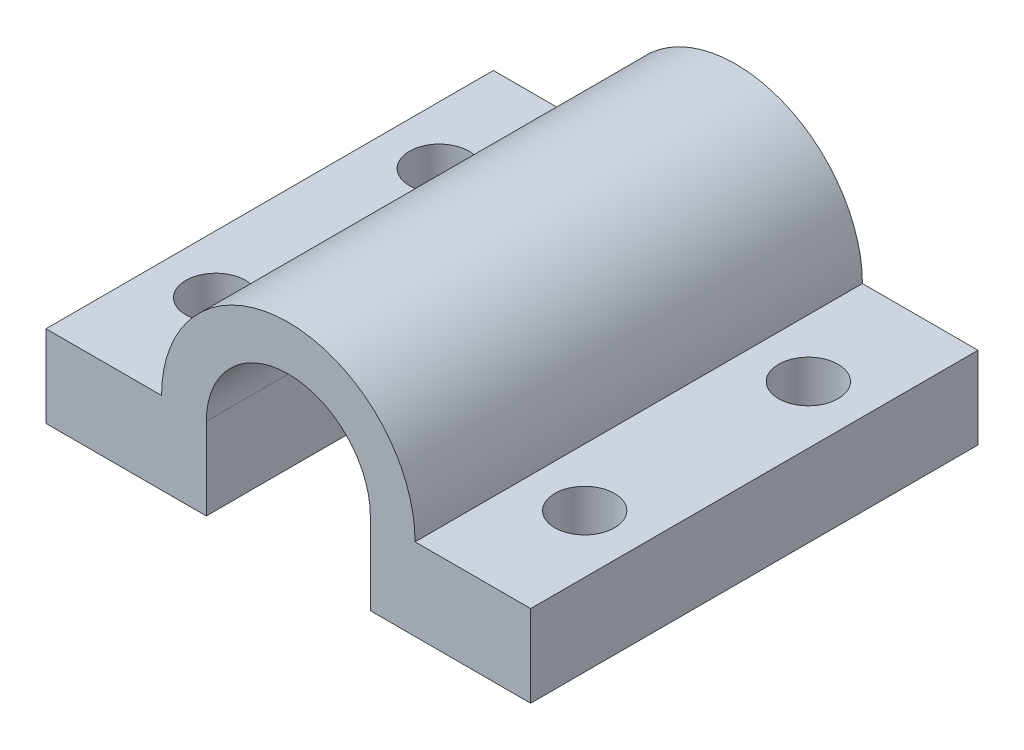
from build123d import *

# Parameters (mm, degrees)
BOSS_EXTRUDE1_DEPTH = 12
SKETCH2_R           = 0.8
CUT_EXTRUDE1_DEPTH  = 20


with BuildPart() as part:
    # Sketch1 → Boss-Extrude1 (new body)
    with BuildSketch(Plane.XY):
        with BuildLine():
            Line((-2.2, 0), (-2.2, -2.2))
            Line((-2.2, -2.2), (-6.5, -2.2))
            Line((-6.5, -2.2), (-6.5, 0))
            Line((-6.5, 0), (-3.4, 0))
            ThreePointArc((-3.4, 0), (0, 3.4), (3.4, 0))
            Line((3.4, 0), (6.5, 0))
            Line((6.5, 0), (6.5, -2.2))
            Line((6.5, -2.2), (2.2, -2.2))
            Line((2.2, -2.2), (2.2, 0))
            ThreePointArc((2.2, 0), (0, 2.2), (-2.2, 0))
        make_face()
    extrude(amount=BOSS_EXTRUDE1_DEPTH)

    # Sketch2 → Cut-Extrude1 (cut)
    with BuildSketch(Plane(origin=(0, 0, 0), x_dir=(1, 0, 0), z_dir=(0, 1, 0))):
        with Locations(Location((-4.95, -3, 0), (0, 0, 270))):
            Circle(SKETCH2_R)
        with Locations(Location((-4.95, -9, 0), (0, 0, 180))):
            Circle(SKETCH2_R)
        with Locations(Location((4.95, -3, 0), (0, 0, 180))):
            Circle(SKETCH2_R)
        with Locations(Location((4.95, -9, 0), (0, 0, 270))):
            Circle(SKETCH2_R)
    extrude(amount=-CUT_EXTRUDE1_DEPTH, mode=Mode.SUBTRACT)


solid = part.part
